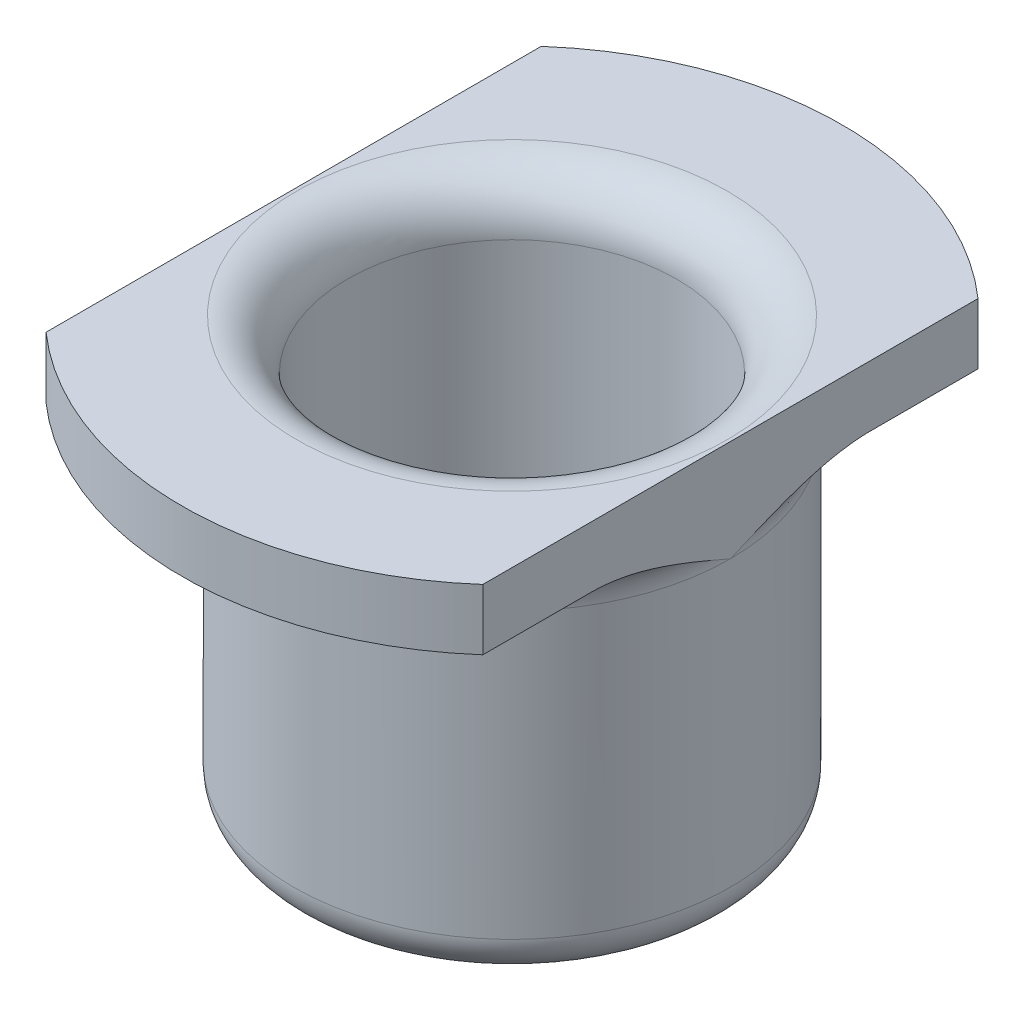
from build123d import *

# Parameters (mm, degrees)
FILETE1_R                  = 2.5
FILETE2_R                  = 1.5
FILETE3_R                  = 2
FILETE4_R                  = 2
CORTE_EXTRUS_O2_DEPTH      = 10
CORTE_EXTRUS_O2_DEPTH_BACK = 10
ESBO_O3_OUTSIDE_W          = 44.606
ESBO_O3_OUTSIDE_H          = 44.606


with BuildPart() as part:
    # Esboço1 → Revolução1 (revolve)
    with BuildSketch(Plane.XY, mode=Mode.PRIVATE) as revolu_o1_sk:
        Polygon((8.1, -2.311461794), (8.1, -20.311461794), (5.35, -20.311461794), (5.35, -23.311461794), (10.75, -23.311461794), (10.75, -5.311461794), (16.25, -5.311461794), (16.25, -2.311461794), align=None)
    revolve(revolu_o1_sk.sketch.rotate(Axis((0, 66.826190476, 0), (0, -1, 0)), 90), axis=Axis((0, 66.826190476, 0), (0, -1, 0)))

    # Filete1
    filete1_edges = [part.edges().sort_by_distance(p)[0] for p in [
        (0, -2.311461794, -8.1),
    ]]
    fillet(filete1_edges, radius=FILETE1_R)

    # Filete2
    filete2_edges = [part.edges().sort_by_distance(p)[0] for p in [
        (0, -20.311461794, -8.1),
    ]]
    fillet(filete2_edges, radius=FILETE2_R)

    # Filete3
    filete3_edges = [part.edges().sort_by_distance(p)[0] for p in [
        (0, -23.311461794, -10.75),
    ]]
    fillet(filete3_edges, radius=FILETE3_R)

    # Filete4
    filete4_edges = [part.edges().sort_by_distance(p)[0] for p in [
        (0, -5.311461794, -10.75),
    ]]
    fillet(filete4_edges, radius=FILETE4_R)

    # Esboço3 outside → Corte-extrusão2 (cut, two sides: drawn at the far end of the back side and taken through both)
    with BuildSketch(Plane.XZ.offset(5.311461794).offset(-CORTE_EXTRUS_O2_DEPTH_BACK)):
        Rectangle(ESBO_O3_OUTSIDE_W, ESBO_O3_OUTSIDE_H)
        Polygon((-10.75, 0), (-10.75, -18.400139995), (10.75, -18.400139995), (10.75, 0), (10.75, 16.970186259), (-10.75, 16.970186259), align=None, mode=Mode.SUBTRACT)
    extrude(amount=CORTE_EXTRUS_O2_DEPTH + CORTE_EXTRUS_O2_DEPTH_BACK, mode=Mode.SUBTRACT)


solid = part.part
